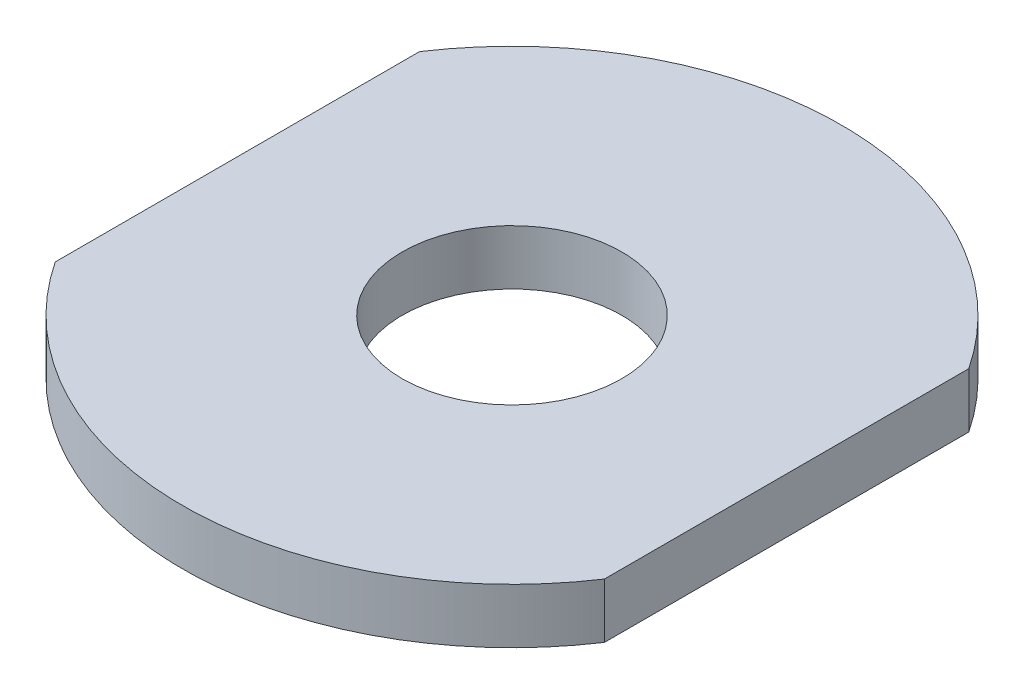
from build123d import *

# Parameters (mm, degrees)
SKETCH1_R           = 6
SKETCH1_R_2         = 2
BOSS_EXTRUDE1_DEPTH = 1
CUT_EXTRUDE1_DEPTH  = 9.544003745


with BuildPart() as part:
    # Sketch1 → Boss-Extrude1 (new body)
    with BuildSketch(Plane(origin=(0, 0, 0), x_dir=(1, 0, 0), z_dir=(0, 1, 0))):
        with Locations(Location((0, 0, 0), (0, 0, 270))):
            Circle(SKETCH1_R)
        with Locations(Location((0, 0, 0), (0, 0, 270))):
            Circle(SKETCH1_R_2, mode=Mode.SUBTRACT)
    extrude(amount=BOSS_EXTRUDE1_DEPTH)

    # Sketch2 → Cut-Extrude1 (cut, through all)
    with BuildSketch(Plane(origin=(0, 1, 0), x_dir=(1, 0, 0), z_dir=(0, 1, 0))):
        with BuildLine():
            Line((-5, -3.31662479), (-5, 3.31662479))
            ThreePointArc((-5, 3.31662479), (-6, 0), (-5, -3.31662479))
        make_face()
        with BuildLine():
            Line((5, 3.31662479), (5, -3.31662479))
            ThreePointArc((5, -3.31662479), (6, 0), (5, 3.31662479))
        make_face()
    extrude(amount=-CUT_EXTRUDE1_DEPTH, mode=Mode.SUBTRACT)


solid = part.part
